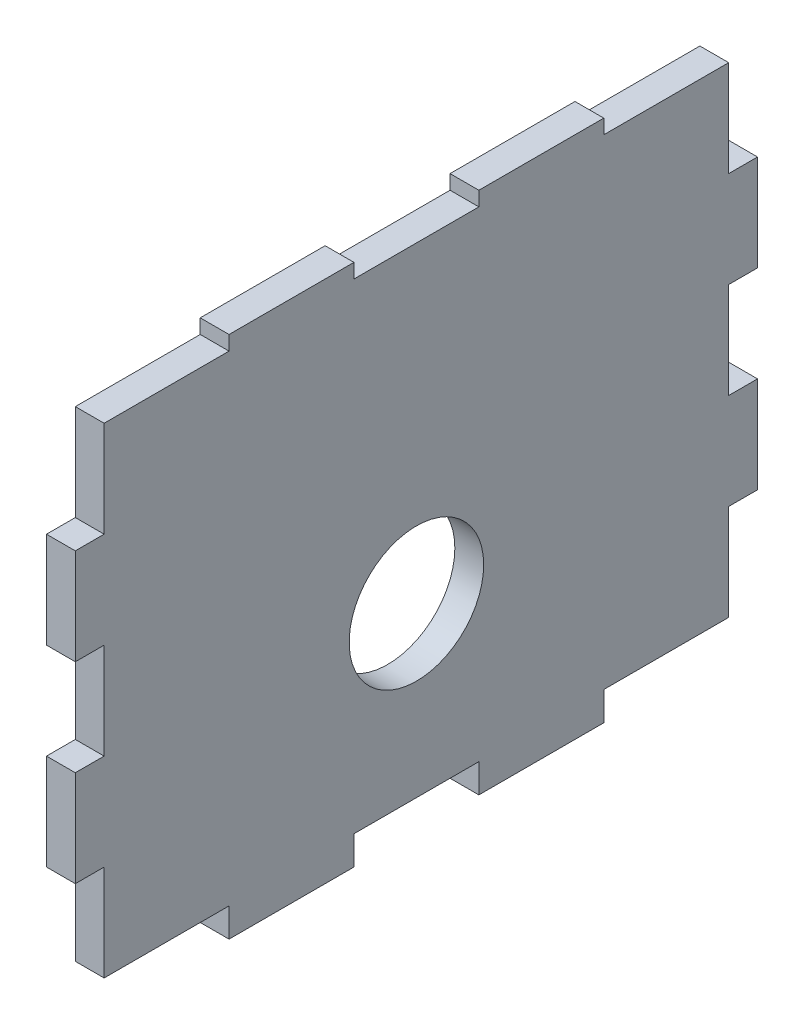
from build123d import *

# Parameters (mm, degrees)
SKETCH1_R           = 14
BOSS_EXTRUDE1_DEPTH = 6


with BuildPart() as part:
    # Sketch1 → Boss-Extrude1 (new body)
    with BuildSketch(Plane(origin=(0, 0, 0), x_dir=(0, 0, -1), z_dir=(1, 0, 0))):
        Polygon((65, -30), (71, -30), (71, -10), (65, -10), (65, 10), (71, 10), (71, 30), (65, 30), (65, 50), (39, 50), (39, 53), (13, 53), (13, 50), (-13, 50), (-13, 53), (-39, 53), (-39, 50), (-65, 50), (-65, 30), (-71, 30), (-71, 10), (-65, 10), (-65, -10), (-71, -10), (-71, -30), (-65, -30), (-65, -50), (-39, -50), (-39, -56), (-13, -56), (-13, -50), (13, -50), (13, -56), (39, -56), (39, -50), (65, -50), align=None)
        with Locations((0, -15)):
            Circle(SKETCH1_R, mode=Mode.SUBTRACT)
    extrude(amount=BOSS_EXTRUDE1_DEPTH)


solid = part.part
